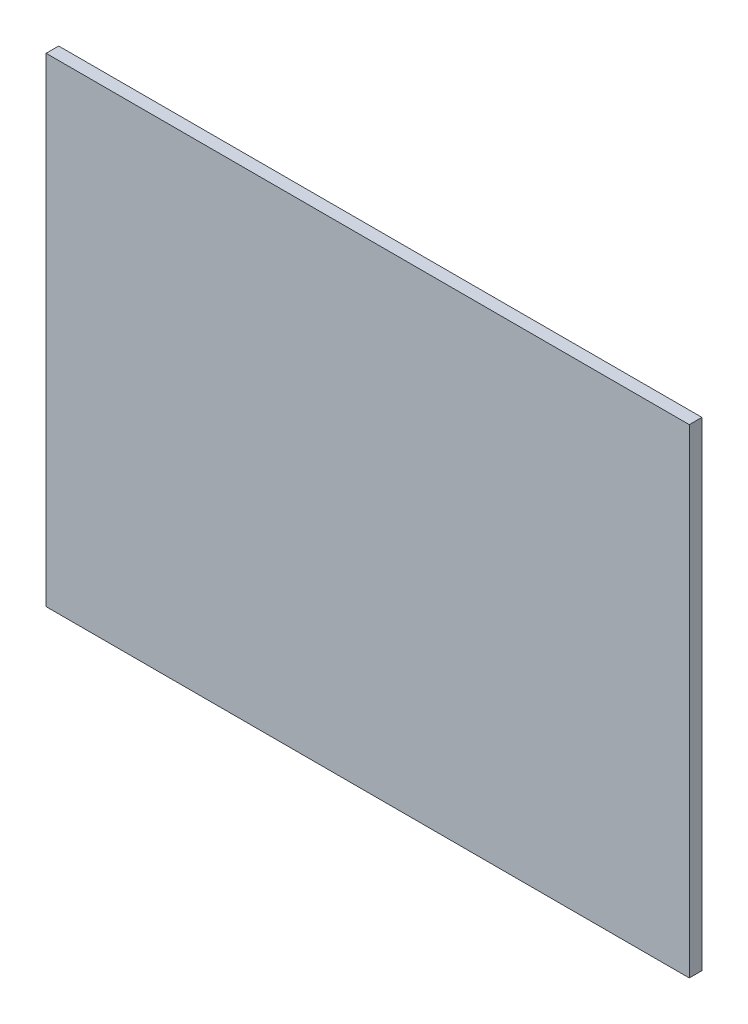
from build123d import *

# Parameters (mm, degrees)
SKETCH2_W           = 510
SKETCH2_H           = 380
BOSS_EXTRUDE1_DEPTH = 10


with BuildPart() as part:
    # Sketch2 → Boss-Extrude1 (new body)
    with BuildSketch(Plane.XY):
        with Locations((255, 190)):
            Rectangle(SKETCH2_W, SKETCH2_H)
    extrude(amount=BOSS_EXTRUDE1_DEPTH)


solid = part.part
